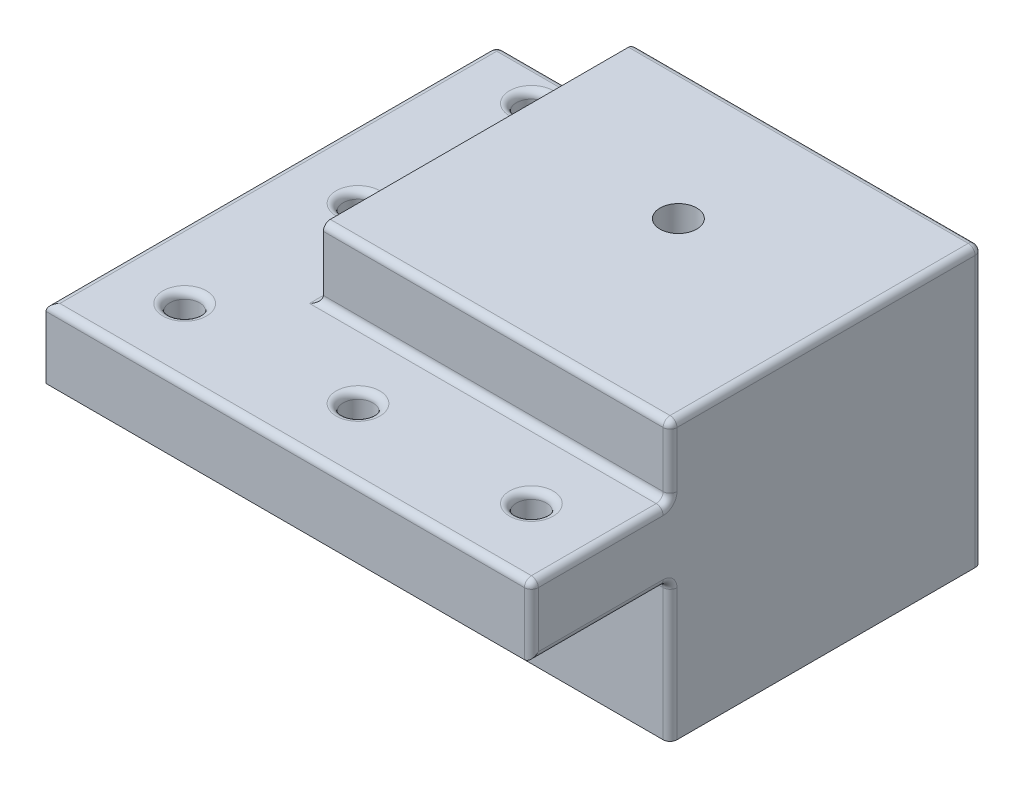
from build123d import *

# Parameters (mm, degrees)
EXTRUDE_1_DEPTH       = 45
SKETCH_2_W            = 30
SKETCH_2_H            = 35
CUT_EXTRUDE_1_DEPTH   = 40.5
SKETCH_4_R            = 2.65
CUT_EXTRUDE_2_DEPTH   = 40
SKETCH_6_R            = 2.65
CUT_EXTRUDE_4_DEPTH   = 97.566039579
SKETCH_7_W            = 55
SKETCH_7_H            = 3
CUT_EXTRUDE_5_DEPTH   = 97.566039579
SKETCH_8_W            = 55
SKETCH_8_H            = 39
CUT_EXTRUDE_6_DEPTH   = 97.566039579
SKETCH_9_R            = 2.15
SKETCH_9_W            = 20
SKETCH_9_H            = 45
EXTRUDE_2_DEPTH       = 20
SKETCH_10_OUTSIDE_W   = 92.712
SKETCH_10_OUTSIDE_H   = 87.712
SKETCH_10_OUTSIDE_W_2 = 50
SKETCH_10_OUTSIDE_H_2 = 45
CUT_EXTRUDE_7_DEPTH   = 10
FILLET_1_R            = 1


with BuildPart() as part:
    # 草图1 → 凸台-拉伸1 (new body)
    with BuildSketch(Plane.XY):
        Polygon((25, 0), (-25, 0), (-25, -10), (-80, -10), (-80, -20), (-60, -20), (-60, -40), (60, -40), (60, -20), (80, -20), (80, -10), (25, -10), align=None)
    extrude(amount=EXTRUDE_1_DEPTH)

    # 草图2 → 切除-拉伸1 (cut)
    with BuildSketch(Plane(origin=(0, 0, 0), x_dir=(-1, 0, 0), z_dir=(0, 0, -1))):
        with Locations((0, -22.5)):
            Rectangle(SKETCH_2_W, SKETCH_2_H)
    extrude(amount=-CUT_EXTRUDE_1_DEPTH, mode=Mode.SUBTRACT)

    # 草图4 → 切除-拉伸2 (cut)
    with BuildSketch(Plane.XZ.offset(5)):
        with Locations((0, 18.8)):
            Circle(SKETCH_4_R)
    extrude(amount=-CUT_EXTRUDE_2_DEPTH, mode=Mode.SUBTRACT)

    # 草图6 → 切除-拉伸4 (cut, through all)
    with BuildSketch(Plane(origin=(0, -10, 0), x_dir=(1, 0, 0), z_dir=(0, 1, 0))):
        with Locations(Location((70, -10, 0), (0, 0, 180))):
            Circle(SKETCH_6_R)
        with Locations(Location((70, -35, 0), (0, 0, 180))):
            Circle(SKETCH_6_R)
        with Locations(Location((-70, -35, 0), (0, 0, 180))):
            Circle(SKETCH_6_R)
        with Locations(Location((-70, -10, 0), (0, 0, 270))):
            Circle(SKETCH_6_R)
    extrude(amount=-CUT_EXTRUDE_4_DEPTH, mode=Mode.SUBTRACT)

    # 草图7 → 切除-拉伸5 (cut, through all)
    with BuildSketch(Plane(origin=(0, -10, 0), x_dir=(1, 0, 0), z_dir=(0, 1, 0))):
        with Locations((-52.5, -1.5)):
            Rectangle(SKETCH_7_W, SKETCH_7_H)
        with Locations((-52.5, -43.5)):
            Rectangle(SKETCH_7_W, SKETCH_7_H)
        with Locations((52.5, -43.5)):
            Rectangle(SKETCH_7_W, SKETCH_7_H)
        with Locations((52.5, -1.5)):
            Rectangle(SKETCH_7_W, SKETCH_7_H)
    extrude(amount=-CUT_EXTRUDE_5_DEPTH, mode=Mode.SUBTRACT)

    # 草图8 → 切除-拉伸6 (cut, through all)
    with BuildSketch(Plane(origin=(0, -10, 0), x_dir=(1, 0, 0), z_dir=(0, 1, 0))):
        with Locations((-52.5, -22.5)):
            Rectangle(SKETCH_8_W, SKETCH_8_H)
        with Locations((52.5, -22.5)):
            Rectangle(SKETCH_8_W, SKETCH_8_H)
    extrude(amount=-CUT_EXTRUDE_6_DEPTH, mode=Mode.SUBTRACT)

    # 草图9 → 凸台-拉伸2 (add)
    # profile 1 of 2: a face of its own
    with BuildSketch(Plane(origin=(0, 0, 0), x_dir=(1, 0, 0), z_dir=(0, 1, 0))):
        Polygon((-25, -45), (-45, -45), (-45, -65), (25, -65), (25, -45), align=None)
        with Locations(Location((15, -55, 0), (0, 0, 270))):
            Circle(SKETCH_9_R, mode=Mode.SUBTRACT)
        with Locations(Location((-10, -55, 0), (0, 0, 270))):
            Circle(SKETCH_9_R, mode=Mode.SUBTRACT)
        with Locations(Location((-35, -55, 0), (0, 0, 270))):
            Circle(SKETCH_9_R, mode=Mode.SUBTRACT)
    # profile 2 of 2: a face of its own
    with BuildSketch(Plane(origin=(0, 0, 0), x_dir=(1, 0, 0), z_dir=(0, 1, 0))):
        with Locations((-35, -22.5)):
            Rectangle(SKETCH_9_W, SKETCH_9_H)
        with Locations(Location((-35, -5, 0), (0, 0, 270))):
            Circle(SKETCH_9_R, mode=Mode.SUBTRACT)
        with Locations(Location((-35, -30, 0), (0, 0, 270))):
            Circle(SKETCH_9_R, mode=Mode.SUBTRACT)
    extrude(amount=-EXTRUDE_2_DEPTH)

    # 草图10 outside → 切除-拉伸7 (cut)
    with BuildSketch(Plane(origin=(0, 0, 0), x_dir=(1, 0, 0), z_dir=(0, 1, 0))):
        with Locations((-10, -32.5)):
            Rectangle(SKETCH_10_OUTSIDE_W, SKETCH_10_OUTSIDE_H)
        with Locations((0, -22.5)):
            Rectangle(SKETCH_10_OUTSIDE_W_2, SKETCH_10_OUTSIDE_H_2, mode=Mode.SUBTRACT)
    extrude(amount=-CUT_EXTRUDE_7_DEPTH, mode=Mode.SUBTRACT)

    # 圆角1
    fillet_1_edges = [part.edges().sort_by_distance(p)[0] for p in [
        (25, -30, 45),
        (-25, -30, 0),
        (25, -5, 45),
        (-25, -5, 0),
        (25, 0, 22.5),
        (25, -20, 0),
        (-25, -30, 45),
        (-35, -10, 27.85),
        (15, -10, 52.85),
        (-10, -10, 52.85),
        (-35, -10, 52.85),
        (-35, -10, 2.85),
        (0, -20, 45),
        (-25, -20, 22.5),
        (-35, -20, 0),
        (25, -20, 55),
        (25, -15, 65),
        (-45, -15, 0),
        (-10, -10, 65),
        (-45, -10, 32.5),
        (25, -10, 55),
        (-25, -10, 22.5),
        (0, -10, 45),
        (-35, -10, 0),
        (0, 0, 0),
        (0, 0, 45),
    ]]
    fillet(fillet_1_edges, radius=FILLET_1_R)


solid = part.part
